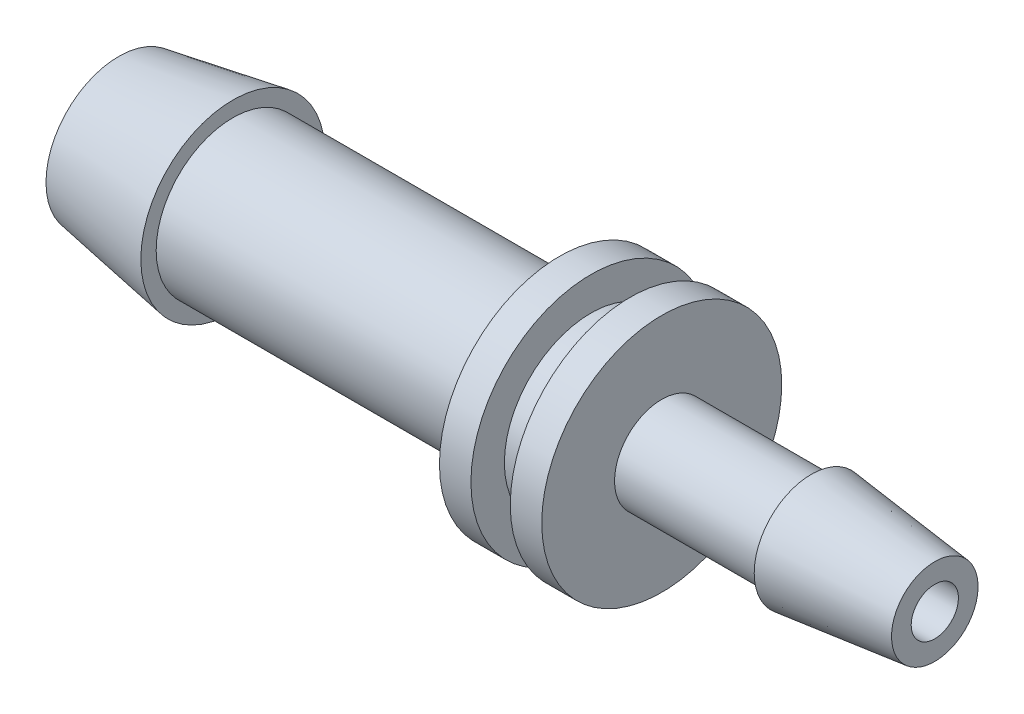
from build123d import *


with BuildPart() as part:
    # Sketch1 → Revolve1 (revolve)
    with BuildSketch(Plane.XY, mode=Mode.PRIVATE) as revolve1_sk:
        Polygon((0, 2.3495), (0, 0.762), (26.3398, 0.762), (26.3398, 1.397), (22.352, 1.8415), (22.352, 1.524), (17.526, 1.524), (17.526, 3.8735), (16.51, 3.8735), (16.51, 2.794), (15.24, 2.794), (15.24, 3.8735), (14.224, 3.8735), (14.224, 2.4765), (3.683, 2.4765), (3.683, 2.9718), align=None)
    revolve(revolve1_sk.sketch.rotate(Axis((0, 0, 0), (1, 0, 0)), 90), axis=Axis((0, 0, 0), (1, 0, 0)))


solid = part.part
